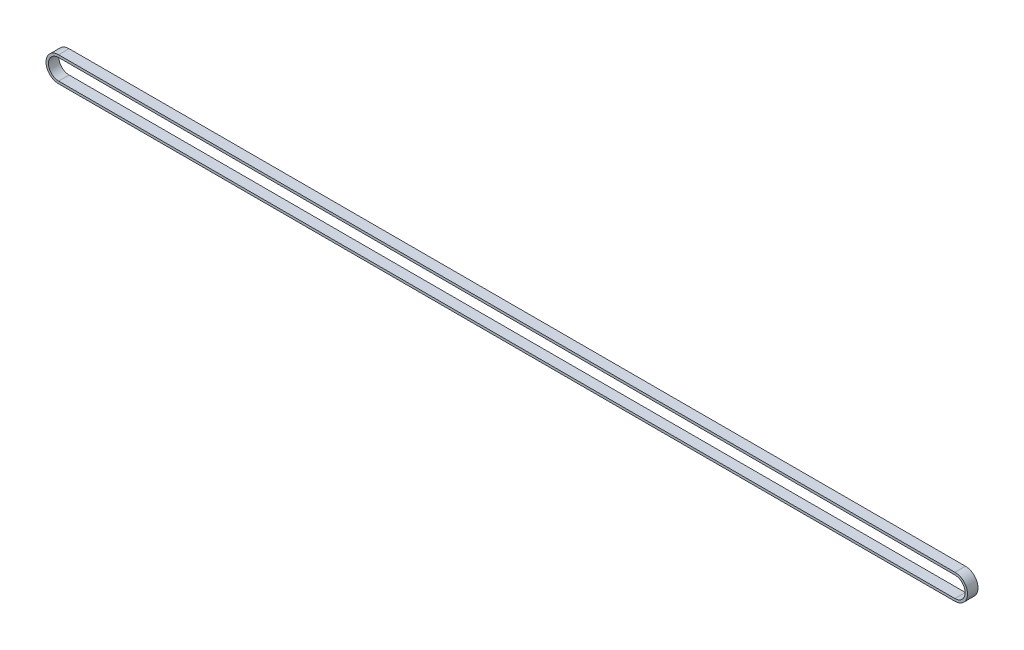
from build123d import *

# Parameters (mm, degrees)
BOSS_EXTRUDE1_DEPTH = 6


with BuildPart() as part:
    # Sketch1 → Boss-Extrude1 (new body)
    with BuildSketch(Plane.XY):
        with BuildLine():
            Line((0, 7.213), (513, 7.213))
            ThreePointArc((513, 7.213), (520.213, 0), (513, -7.213))
            Line((513, -7.213), (0, -7.213))
            ThreePointArc((0, -7.213), (-7.213, 0), (0, 7.213))
        make_face()
        with BuildLine():
            Line((0, 5.833), (513, 5.833))
            ThreePointArc((513, 5.833), (518.833, 0), (513, -5.833))
            Line((513, -5.833), (0, -5.833))
            ThreePointArc((0, -5.833), (-5.833, 0), (0, 5.833))
        make_face(mode=Mode.SUBTRACT)
    extrude(amount=BOSS_EXTRUDE1_DEPTH)


solid = part.part
